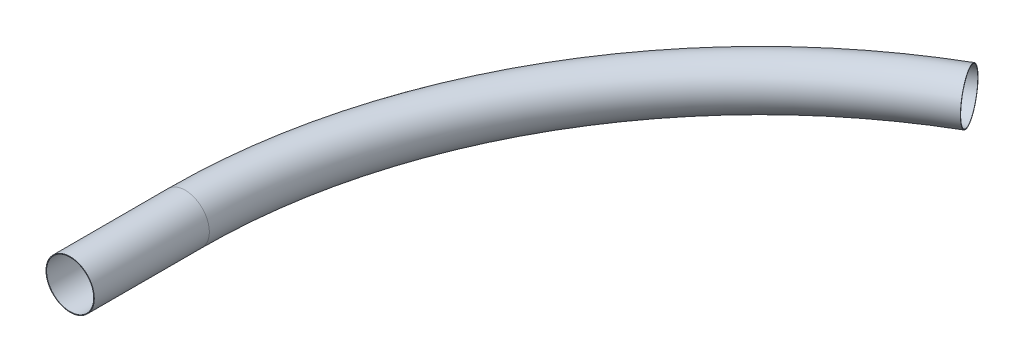
from build123d import *

# Parameters (mm, degrees)
SKETCH_1_R   = 210
SKETCH_1_R_2 = 205


with BuildPart() as part:
    # 扫描1: sweep along a path in 草图2
    with BuildLine(Plane(origin=(0, 0, 0), x_dir=(1, 0, 0), z_dir=(0, 1, 0))) as sweep_1_path:
        Line((0, 0), (0, 1000))
        ThreePointArc((0, 1000), (667.42667475, 3495.758077484), (2491.523352531, 5325.221949115))
    # 草图1 → 扫描1 (sweep)
    with BuildSketch(Plane.XY):
        Circle(SKETCH_1_R)
        Circle(SKETCH_1_R_2, mode=Mode.SUBTRACT)
    sweep(path=sweep_1_path.line)


solid = part.part
